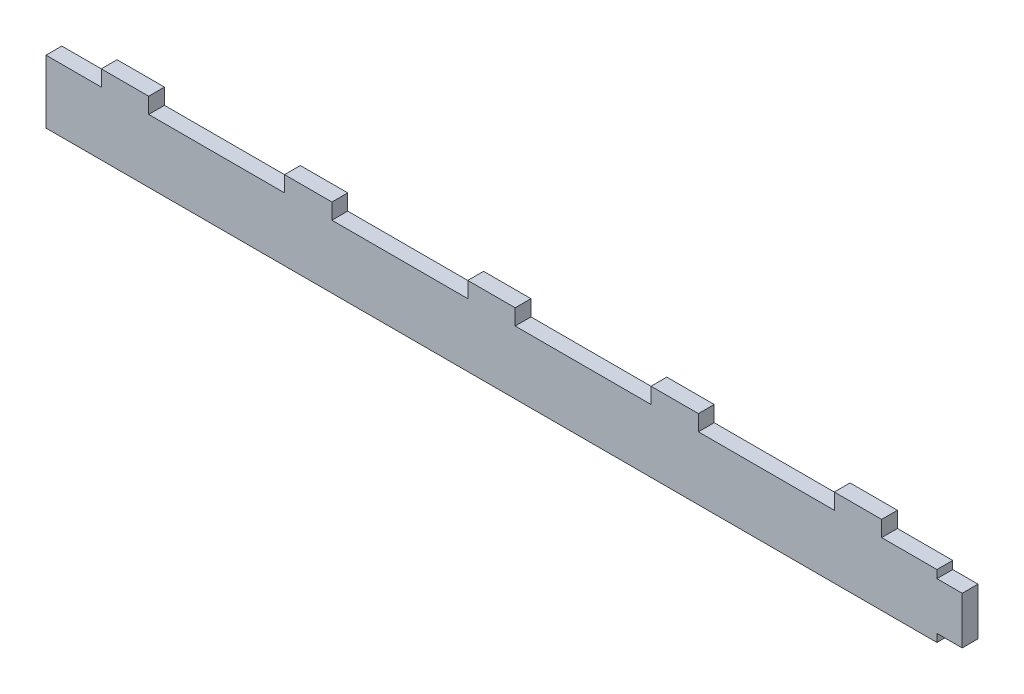
from build123d import *

# Parameters (mm, degrees)
BOSS_EXTRU_2_DEPTH = 5


with BuildPart() as part:
    # Esquisse1 → Boss.-Extru.2 (new body)
    with BuildSketch(Plane.XY):
        Polygon((-77.295634555, 67.941614749), (-92.295634555, 67.941614749), (-92.295634555, 62.941614749), (-109.795634555, 62.941614749), (-109.795634555, 42.941614749), (172.204365445, 42.941614749), (172.204365445, 45.441614749), (180.204365445, 45.441614749), (180.204365445, 60.441614749), (172.204365445, 60.441614749), (172.204365445, 62.941614749), (154.704365445, 62.941614749), (154.704365445, 67.941614749), (139.704365445, 67.941614749), (139.704365445, 62.941614749), (96.704365445, 62.941614749), (96.704365445, 67.941614749), (81.704365445, 67.941614749), (81.704365445, 62.941614749), (38.704365445, 62.941614749), (38.704365445, 67.941614749), (23.704365445, 67.941614749), (23.704365445, 62.941614749), (-19.295634555, 62.941614749), (-19.295634555, 67.941614749), (-34.295634555, 67.941614749), (-34.295634555, 62.941614749), (-77.295634555, 62.941614749), align=None)
    extrude(amount=BOSS_EXTRU_2_DEPTH)


solid = part.part
